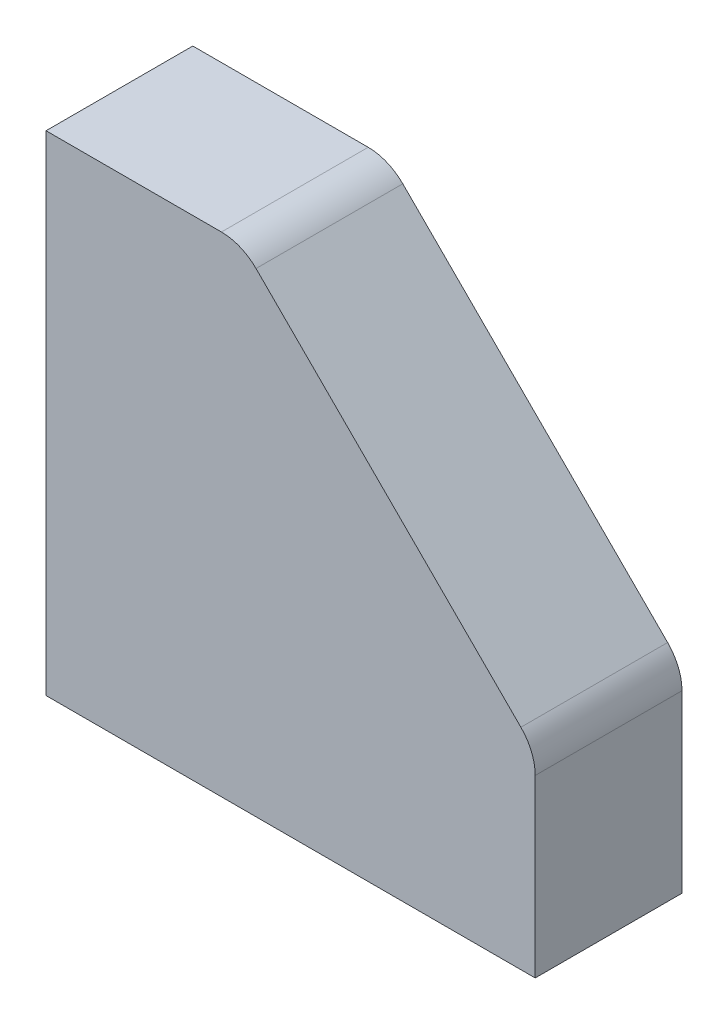
from build123d import *

# Parameters (mm, degrees)
BOSS_EXTRUDE1_DEPTH   = 15
M4_TAPPED_HOLE1_D     = 3.3
M4_TAPPED_HOLE1_DEPTH = 9.108579979
M4_TAPPED_HOLE1_TIP   = 0.991420021
M4_TAPPED_HOLE2_D     = 3.3
M4_TAPPED_HOLE2_DEPTH = 9.108579979
M4_TAPPED_HOLE2_TIP   = 0.991420021
FILLET1_R             = 5


with BuildPart() as part:
    # Sketch1 → Boss-Extrude1 (new body)
    with BuildSketch(Plane.XY):
        Polygon((0, 50), (20, 50), (50, 20), (50, 0), (0, 0), align=None)
    extrude(amount=BOSS_EXTRUDE1_DEPTH)

    # M4 Tapped Hole1
    with Locations(Plane(origin=(0, 40, 7.5), x_dir=(0, 0, -1), z_dir=(-1, 0, 0))):
        with Locations((0, 0), (0, 25)):
            Hole(M4_TAPPED_HOLE1_D / 2, depth=M4_TAPPED_HOLE1_DEPTH)
            with Locations((0, 0, -(M4_TAPPED_HOLE1_DEPTH + M4_TAPPED_HOLE1_TIP / 2))):  # 118° drill point
                Cone(0, M4_TAPPED_HOLE1_D / 2, M4_TAPPED_HOLE1_TIP, mode=Mode.SUBTRACT)

    # M4 Tapped Hole2
    with Locations(Plane(origin=(0, 0, 0), x_dir=(-1, 0, 0), z_dir=(0, -1, 0))):
        with Locations((-35, -7.5), (-20, -7.5), (-5, -7.5)):
            Hole(M4_TAPPED_HOLE2_D / 2, depth=M4_TAPPED_HOLE2_DEPTH)
            with Locations((0, 0, -(M4_TAPPED_HOLE2_DEPTH + M4_TAPPED_HOLE2_TIP / 2))):  # 118° drill point
                Cone(0, M4_TAPPED_HOLE2_D / 2, M4_TAPPED_HOLE2_TIP, mode=Mode.SUBTRACT)

    # Fillet1
    fillet1_edges = [part.edges().sort_by_distance(p)[0] for p in [
        (20, 50, 7.5),
        (50, 20, 7.5),
    ]]
    fillet(fillet1_edges, radius=FILLET1_R)


solid = part.part
